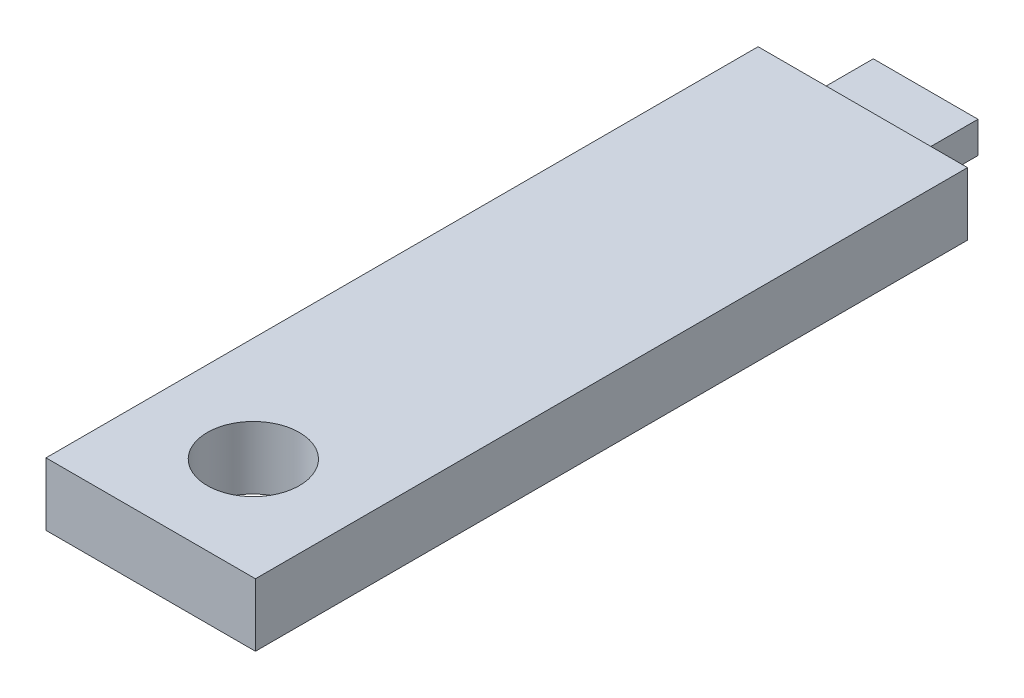
from build123d import *

# Parameters (mm, degrees)
SKETCH1_W           = 5
SKETCH1_H           = 1.5
BOSS_EXTRUDE1_DEPTH = 3
SKETCH2_W           = 10
SKETCH2_H           = 3
BOSS_EXTRUDE2_DEPTH = 34
SKETCH3_R           = 2.2
CUT_EXTRUDE1_DEPTH  = 38.871493237


with BuildPart() as part:
    # Sketch1 → Boss-Extrude1 (new body)
    with BuildSketch(Plane.XY):
        with Locations((2.5, 0.75)):
            Rectangle(SKETCH1_W, SKETCH1_H)
    extrude(amount=BOSS_EXTRUDE1_DEPTH)

    # Sketch2 → Boss-Extrude2 (add)
    with BuildSketch(Plane.XY.offset(3)):
        with Locations((2.5, 0.75)):
            Rectangle(SKETCH2_W, SKETCH2_H)
    extrude(amount=BOSS_EXTRUDE2_DEPTH)

    # Sketch3 → Cut-Extrude1 (cut, through all)
    with BuildSketch(Plane.XZ.offset(0.75)):
        with Locations(Location((2.5, 32.1, 0), (0, 0, 270))):
            Circle(SKETCH3_R)
    extrude(amount=-CUT_EXTRUDE1_DEPTH, mode=Mode.SUBTRACT)


solid = part.part
